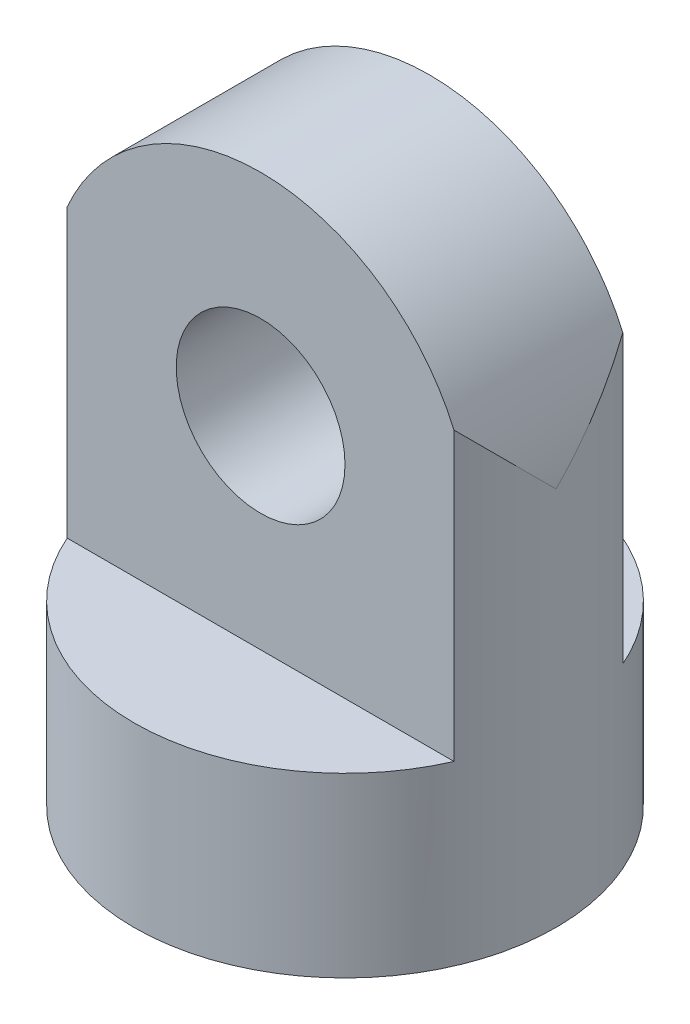
from build123d import *

# Parameters (mm, degrees)
SKETCH1_R           = 2.5
SKETCH1_R_2         = 1
BOSS_EXTRUDE2_DEPTH = 2.1
SKETCH2_R           = 1
BOSS_EXTRUDE3_DEPTH = 1
SKETCH4_R           = 1
CUT_EXTRUDE13_DEPTH = 2
SKETCH6_OUTSIDE_W   = 8.99
SKETCH6_OUTSIDE_H   = 8.99
SKETCH6_OUTSIDE_R   = 2.5
CUT_EXTRUDE14_DEPTH = 8.842193571


with BuildPart() as part:
    # Sketch1 → Boss-Extrude2 (new body)
    with BuildSketch(Plane(origin=(0, 0, 0), x_dir=(1, 0, 0), z_dir=(0, 1, 0))):
        with Locations(Location((0, 0, 0), (0, 0, 270))):
            Circle(SKETCH1_R)
        with Locations(Location((0, 0, 0), (0, 0, 270))):
            Circle(SKETCH1_R_2, mode=Mode.SUBTRACT)
    extrude(amount=BOSS_EXTRUDE2_DEPTH)

    # Sketch2 → Boss-Extrude3 (add, symmetric)
    with BuildSketch(Plane.XY):
        with BuildLine():
            Line((2.5, 4.5), (2.5, 0))
            Line((2.5, 0), (-2.5, 0))
            Line((-2.5, 0), (-2.5, 4.5))
            ThreePointArc((-2.5, 4.5), (0, 7), (2.5, 4.5))
        make_face()
        with Locations((0, 4.5)):
            Circle(SKETCH2_R, mode=Mode.SUBTRACT)
    extrude(amount=BOSS_EXTRUDE3_DEPTH, both=True)

    # Sketch4 → Cut-Extrude13 (cut)
    with BuildSketch(Plane.XZ):
        with Locations(Location((0, 0, 0), (0, 0, 270))):
            Circle(SKETCH4_R)
    extrude(amount=-CUT_EXTRUDE13_DEPTH, mode=Mode.SUBTRACT)

    # Sketch6 outside → Cut-Extrude14 (cut, through all)
    with BuildSketch(Plane.XZ):
        Rectangle(SKETCH6_OUTSIDE_W, SKETCH6_OUTSIDE_H)
        with Locations(Location((0, 0, 0), (0, 0, 336.421821522))):
            Circle(SKETCH6_OUTSIDE_R, mode=Mode.SUBTRACT)
    extrude(amount=-CUT_EXTRUDE14_DEPTH, mode=Mode.SUBTRACT)


solid = part.part
